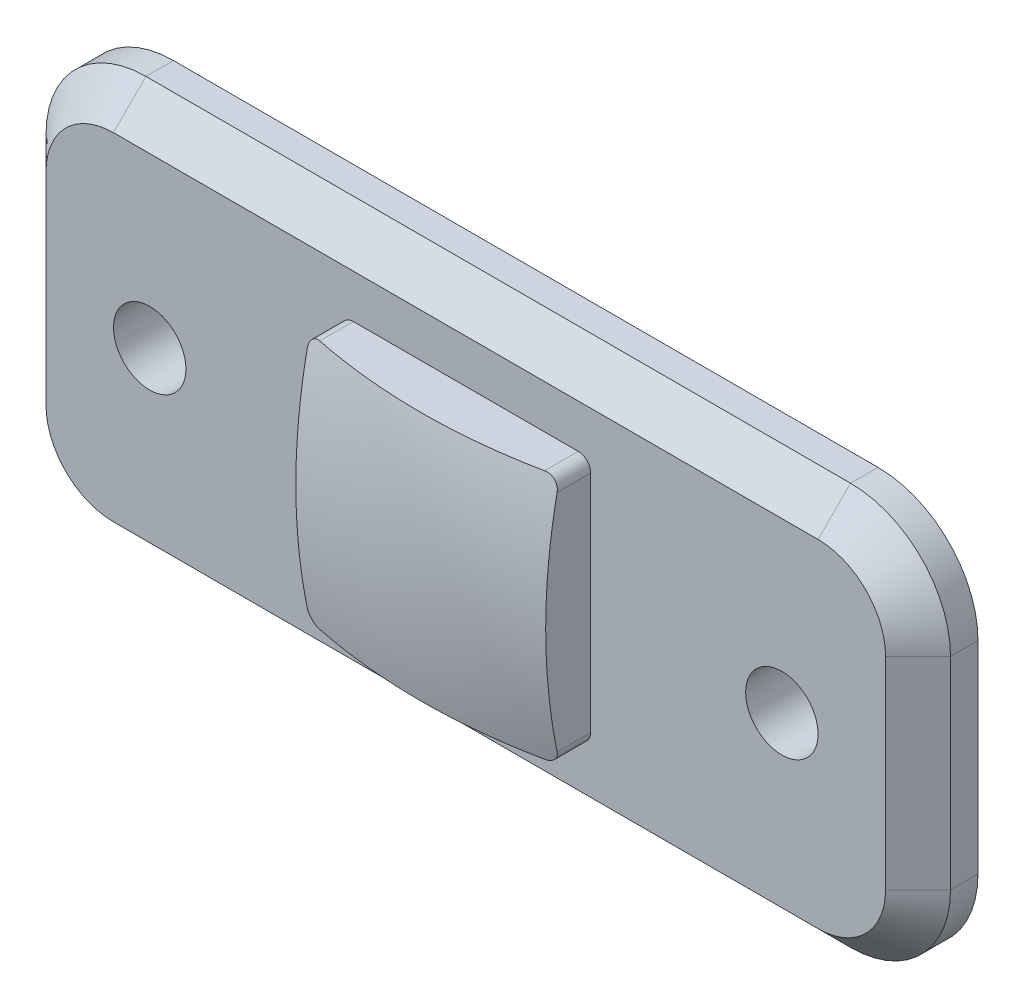
from build123d import *

# Parameters (mm, degrees)
IZIM1_R                     = 1.45
Y_KSEKLIK_EKSTR_ZYON1_DEPTH = 2.4
Y_KSEKLIK_EKSTR_ZYON2_DEPTH = 2.35
PAH1_SIZE                   = 1.3
RADYUS1_R                   = 2.5


with BuildPart() as part:
    # Çizim1 → Yükseklik-Ekstrüzyon1 (new body)
    with BuildSketch(Plane.XY):
        with BuildLine():
            Line((-14.1, 8.045), (14.1, 8.045))
            ThreePointArc((14.1, 8.045), (16.928427125, 6.873427125), (18.1, 4.045))
            Line((18.1, 4.045), (18.1, -4.045))
            ThreePointArc((18.1, -4.045), (16.928427125, -6.873427125), (14.1, -8.045))
            Line((14.1, -8.045), (-14.1, -8.045))
            ThreePointArc((-14.1, -8.045), (-16.928427125, -6.873427125), (-18.1, -4.045))
            Line((-18.1, -4.045), (-18.1, 4.045))
            ThreePointArc((-18.1, 4.045), (-16.928427125, 6.873427125), (-14.1, 8.045))
        make_face()
        with Locations((-12.65, 0)):
            Circle(IZIM1_R, mode=Mode.SUBTRACT)
        with Locations(Location((12.65, 0, 0), (0, 0, 180))):
            Circle(IZIM1_R, mode=Mode.SUBTRACT)
    extrude(amount=Y_KSEKLIK_EKSTR_ZYON1_DEPTH)

    # Çizim2 → Yükseklik-Ekstrüzyon2 (add)
    with BuildSketch(Plane.XY.offset(2.4)):
        with BuildLine():
            Line((-4.5, 5), (4.5, 5))
            ThreePointArc((4.5, 5), (4.853553391, 4.853553391), (5, 4.5))
            Line((5, 4.5), (5, -4.5))
            ThreePointArc((5, -4.5), (4.853553391, -4.853553391), (4.5, -5))
            Line((4.5, -5), (-4.5, -5))
            ThreePointArc((-4.5, -5), (-4.853553391, -4.853553391), (-5, -4.5))
            Line((-5, -4.5), (-5, 4.5))
            ThreePointArc((-5, 4.5), (-4.853553391, 4.853553391), (-4.5, 5))
        make_face()
    extrude(amount=Y_KSEKLIK_EKSTR_ZYON2_DEPTH)

    # Çizim3 → Kes-Döndür1 (revolve, cut)
    with BuildSketch(Plane(origin=(0, 0, 0), x_dir=(1, 0, 0), z_dir=(0, 1, 0))):
        with BuildLine():
            Line((0, -8.133060599), (11.181129459, -8.714892386))
            Line((11.181129459, -8.714892386), (7.979795791, -3.321493976))
            ThreePointArc((7.979795791, -3.321493976), (4.05332488, -4.390057277), (0, -4.75))
            Line((0, -4.75), (0, -8.133060599))
        make_face()
        with BuildLine():
            Line((3.765, 0), (5.976478481, 3.08469305))
            Line((5.976478481, 3.08469305), (3.765, 3.765))
            Line((3.765, 3.765), (0, 3.765))
            Line((0, 3.765), (0, -3.765))
            ThreePointArc((0, -3.765), (2.662257031, -2.662257031), (3.765, 0))
        make_face()
    revolve(axis=Axis((0, 0, 8.133060599), (0, 0, -1)), mode=Mode.SUBTRACT)

    # Pah1
    pah1_edges = [part.edges().sort_by_distance(p)[0] for p in [
        (16.928427125, -6.873427125, 2.4),
        (18.1, 0, 2.4),
        (16.928427125, 6.873427125, 2.4),
        (0, 8.045, 2.4),
        (-16.928427125, 6.873427125, 2.4),
        (-18.1, 0, 2.4),
        (-16.928427125, -6.873427125, 2.4),
        (0, -8.045, 2.4),
    ]]
    chamfer(pah1_edges, length=PAH1_SIZE)

    # Radyus1
    radyus1_edges = [part.edges().sort_by_distance(p)[0] for p in [
        (-3.765, 0, 0),
    ]]
    fillet(radyus1_edges, radius=RADYUS1_R)


solid = part.part
